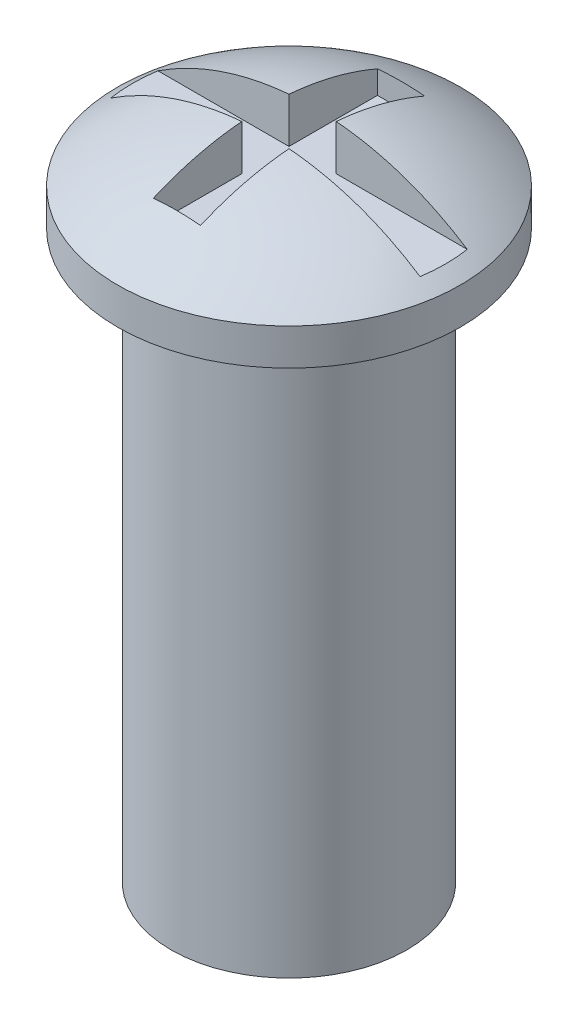
from build123d import *

# Parameters (mm, degrees)
SKETCH_1_R          = 2.5
EXTRUDE_1_DEPTH     = 12
SKETCH_2_R          = 3.635
EXTRUDE_2_DEPTH     = 2
SKETCH_3_W          = 10.772084644
SKETCH_3_H          = 1
CUT_EXTRUDE_1_DEPTH = 1
SKETCH_4_W          = 1
SKETCH_4_H          = 4.75
CUT_EXTRUDE_2_DEPTH = 1


with BuildPart() as part:
    # 草图1 → 拉伸1 (new body)
    with BuildSketch(Plane(origin=(0, 0, 0), x_dir=(1, 0, 0), z_dir=(0, 1, 0))):
        with Locations(Location((0, 0, 0), (0, 0, 270))):
            Circle(SKETCH_1_R)
    extrude(amount=EXTRUDE_1_DEPTH)

    # 草图2 → 拉伸2 (add)
    with BuildSketch(Plane(origin=(0, 12, 0), x_dir=(-1, 0, 0), z_dir=(0, 1, 0))):
        with Locations(Location((0, 0, 0), (0, 0, 90))):
            Circle(SKETCH_2_R)
    extrude(amount=EXTRUDE_2_DEPTH)

    # 草图3 → 切除-拉伸1 (cut)
    with BuildSketch(Plane(origin=(0, 14, 0), x_dir=(-1, 0, 0), z_dir=(0, 1, 0))):
        Rectangle(SKETCH_3_W, SKETCH_3_H)
    extrude(amount=-CUT_EXTRUDE_1_DEPTH, mode=Mode.SUBTRACT)

    # 草图4 → 切除-拉伸2 (cut)
    with BuildSketch(Plane(origin=(0, 14, 0), x_dir=(-1, 0, 0), z_dir=(0, 1, 0))):
        Rectangle(SKETCH_4_W, SKETCH_4_H)
    extrude(amount=-CUT_EXTRUDE_2_DEPTH, mode=Mode.SUBTRACT)

    # 草图5 → 切除-旋转16 (revolve, cut)
    with BuildSketch(Plane(origin=(0, 0, 0), x_dir=(0, 0, -1), z_dir=(1, 0, 0)), mode=Mode.PRIVATE) as cut_revolve_16_sk:
        with BuildLine():
            Line((0, 14.65344885), (-4.227714807, 14.65344885))
            Line((-4.227714807, 14.65344885), (-4.227714807, 12.257514241))
            ThreePointArc((-4.227714807, 12.257514241), (-2.28636333, 13.54730049), (0, 14))
            Line((0, 14), (0, 14.65344885))
        make_face()
    revolve(cut_revolve_16_sk.sketch.rotate(Axis((0, -2.105917543, 0), (0, 1, 0)), 180), axis=Axis((0, -2.105917543, 0), (0, 1, 0)), mode=Mode.SUBTRACT)


solid = part.part
